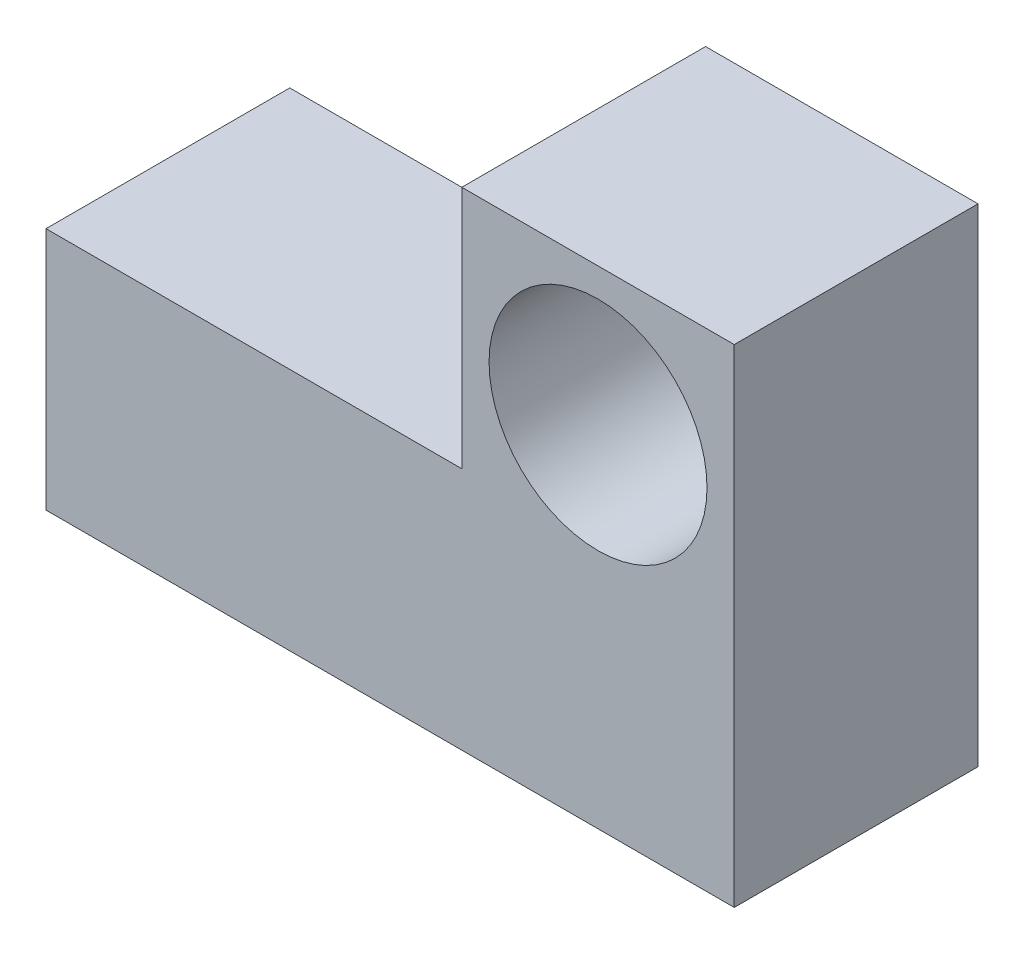
from build123d import *

# Parameters (mm, degrees)
SKETCH1_W           = 30.48
SKETCH1_H           = 10.795
BOSS_EXTRUDE1_DEPTH = 10.795
SKETCH2_R           = 4.826
CUT_EXTRUDE1_DEPTH  = 26.67
SKETCH3_W           = 12.065
SKETCH3_H           = 10.795
BOSS_EXTRUDE2_DEPTH = 10.795
SKETCH4_R           = 4.826
CUT_EXTRUDE2_DEPTH  = 25.4


with BuildPart() as part:
    # Sketch1 → Boss-Extrude1 (new body)
    with BuildSketch(Plane(origin=(0, 0, 0), x_dir=(1, 0, 0), z_dir=(0, 1, 0))):
        Rectangle(SKETCH1_W, SKETCH1_H)
    extrude(amount=BOSS_EXTRUDE1_DEPTH)

    # Sketch2 → Cut-Extrude1 (cut)
    with BuildSketch(Plane.ZY.offset(15.24)):
        with Locations((0, 5.3975)):
            Circle(SKETCH2_R)
    extrude(amount=-CUT_EXTRUDE1_DEPTH, mode=Mode.SUBTRACT)

    # Sketch3 → Boss-Extrude2 (add)
    with BuildSketch(Plane(origin=(0, 10.795, 0), x_dir=(1, 0, 0), z_dir=(0, 1, 0))):
        with Locations((9.2075, 0)):
            Rectangle(SKETCH3_W, SKETCH3_H)
    extrude(amount=BOSS_EXTRUDE2_DEPTH)

    # Sketch4 → Cut-Extrude2 (cut)
    with BuildSketch(Plane(origin=(0, 0, -5.3975), x_dir=(-1, 0, 0), z_dir=(0, 0, -1))):
        with Locations((-9.2075, 15.494)):
            Circle(SKETCH4_R)
    extrude(amount=-CUT_EXTRUDE2_DEPTH, mode=Mode.SUBTRACT)


solid = part.part
